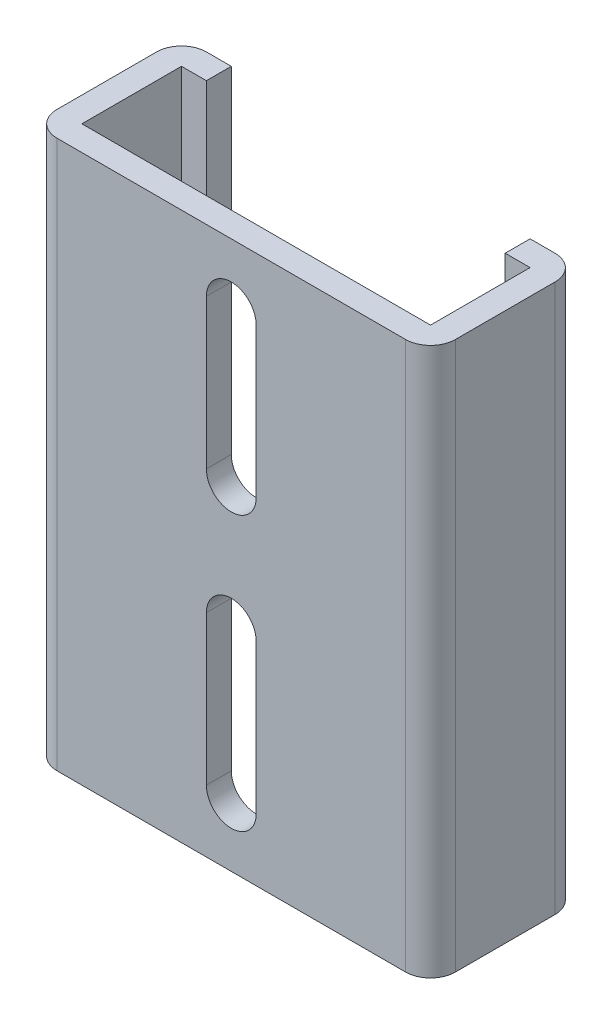
from build123d import *

# Parameters (mm, degrees)
EXTRUDE_THIN1_DEPTH = 11
CUT_EXTRUDE1_DEPTH  = 1


with BuildPart() as part:
    # Sketch1 → Extrude-Thin1 (new body)
    with BuildSketch(Plane(origin=(0, 0, 0), x_dir=(1, 0, 0), z_dir=(0, 1, 0))):
        with BuildLine():
            Line((-3, 3), (-3.5, 3))
            ThreePointArc((-3.5, 3), (-3.853553391, 2.853553391), (-4, 2.5))
            Line((-4, 2.5), (-4, 0.5))
            ThreePointArc((-4, 0.5), (-3.853553391, 0.146446609), (-3.5, 0))
            Line((-3.5, 0), (3.5, 0))
            ThreePointArc((3.5, 0), (3.853553391, 0.146446609), (4, 0.5))
            Line((4, 0.5), (4, 2.5))
            ThreePointArc((4, 2.5), (3.853553391, 2.853553391), (3.5, 3))
            Line((3.5, 3), (3, 3))
            Line((3, 3), (3, 2.5))
            Line((3, 2.5), (3.5, 2.5))
            Line((3.5, 2.5), (3.5, 0.5))
            Line((3.5, 0.5), (-3.5, 0.5))
            Line((-3.5, 0.5), (-3.5, 2.5))
            Line((-3.5, 2.5), (-3, 2.5))
            Line((-3, 2.5), (-3, 3))
        make_face()
    extrude(amount=EXTRUDE_THIN1_DEPTH)

    # Sketch3 → Cut-Extrude1 (cut)
    with BuildSketch(Plane.XY):
        with BuildLine():
            Line((-0.5, 6.75), (-0.5, 9.75))
            ThreePointArc((-0.5, 9.75), (0, 10.25), (0.5, 9.75))
            Line((0.5, 9.75), (0.5, 6.75))
            ThreePointArc((0.5, 6.75), (0, 6.25), (-0.5, 6.75))
        make_face()
        with BuildLine():
            Line((0.5, 4.25), (0.5, 1.25))
            ThreePointArc((0.5, 1.25), (0, 0.75), (-0.5, 1.25))
            Line((-0.5, 1.25), (-0.5, 4.25))
            ThreePointArc((-0.5, 4.25), (0, 4.75), (0.5, 4.25))
        make_face()
    extrude(amount=-CUT_EXTRUDE1_DEPTH, mode=Mode.SUBTRACT)


solid = part.part
